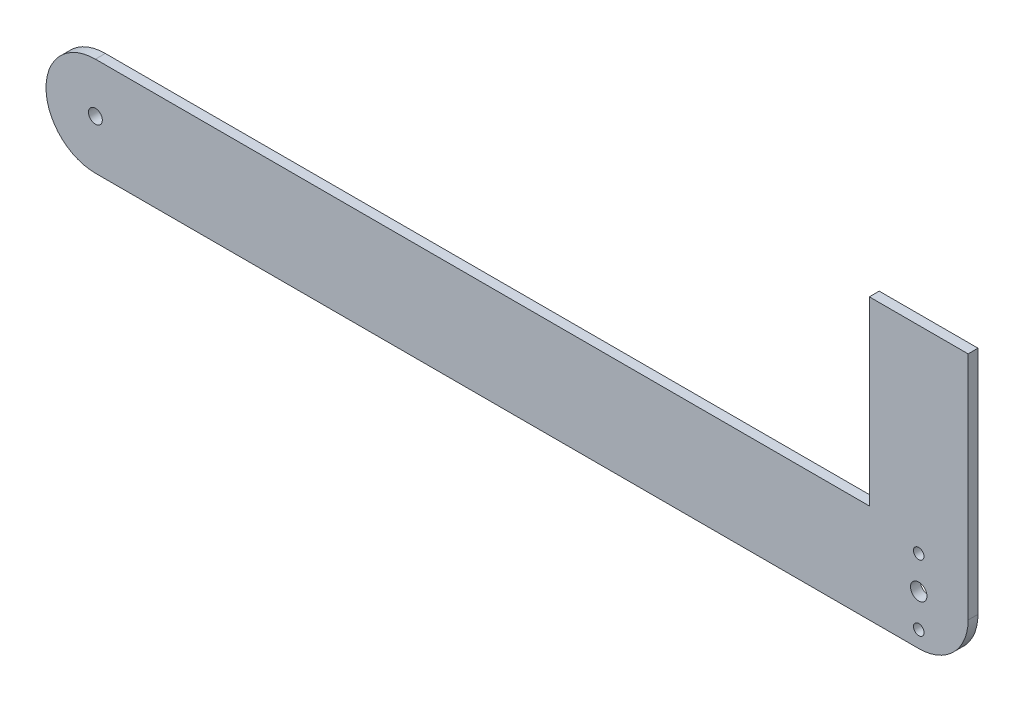
from build123d import *

# Parameters (mm, degrees)
ESQUISSE1_R        = 2.5
ESQUISSE1_R_2      = 2.1
ESQUISSE1_R_3      = 1.6
BOSS_EXTRU_1_DEPTH = 3
BOSS_EXTRU_2_START = -3
ESQUISSE2_R        = 1.6
BOSS_EXTRU_2_DEPTH = 3


with BuildPart() as part:
    # Esquisse1 → Boss.-Extru.1 (new body)
    with BuildSketch(Plane.XY):
        with BuildLine():
            Line((-125, 15), (125, 15))
            ThreePointArc((125, 15), (140, 0), (125, -15))
            Line((125, -15), (-125, -15))
            ThreePointArc((-125, -15), (-140, 0), (-125, 15))
        make_face()
        with Locations((125, 0)):
            Circle(ESQUISSE1_R, mode=Mode.SUBTRACT)
        with Locations((-125, 0)):
            Circle(ESQUISSE1_R_2, mode=Mode.SUBTRACT)
        with Locations((125, 10)):
            Circle(ESQUISSE1_R_3, mode=Mode.SUBTRACT)
        with Locations(Location((125, -10, 0), (0, 0, 180))):
            Circle(ESQUISSE1_R_3, mode=Mode.SUBTRACT)
    extrude(amount=BOSS_EXTRU_1_DEPTH)

    # Esquisse2 → Boss.-Extru.2 (add)
    with BuildSketch(Plane.XY.offset(3).offset(BOSS_EXTRU_2_START)):
        with BuildLine():
            Line((140, 70), (110, 70))
            Line((110, 70), (110, 0))
            Line((110, 0), (122.5, 0))
            ThreePointArc((122.5, 0), (125, 2.5), (127.5, 0))
            Line((127.5, 0), (140, 0))
            Line((140, 0), (140, 70))
        make_face()
        with Locations((125, 10)):
            Circle(ESQUISSE2_R, mode=Mode.SUBTRACT)
    extrude(amount=BOSS_EXTRU_2_DEPTH)


solid = part.part
